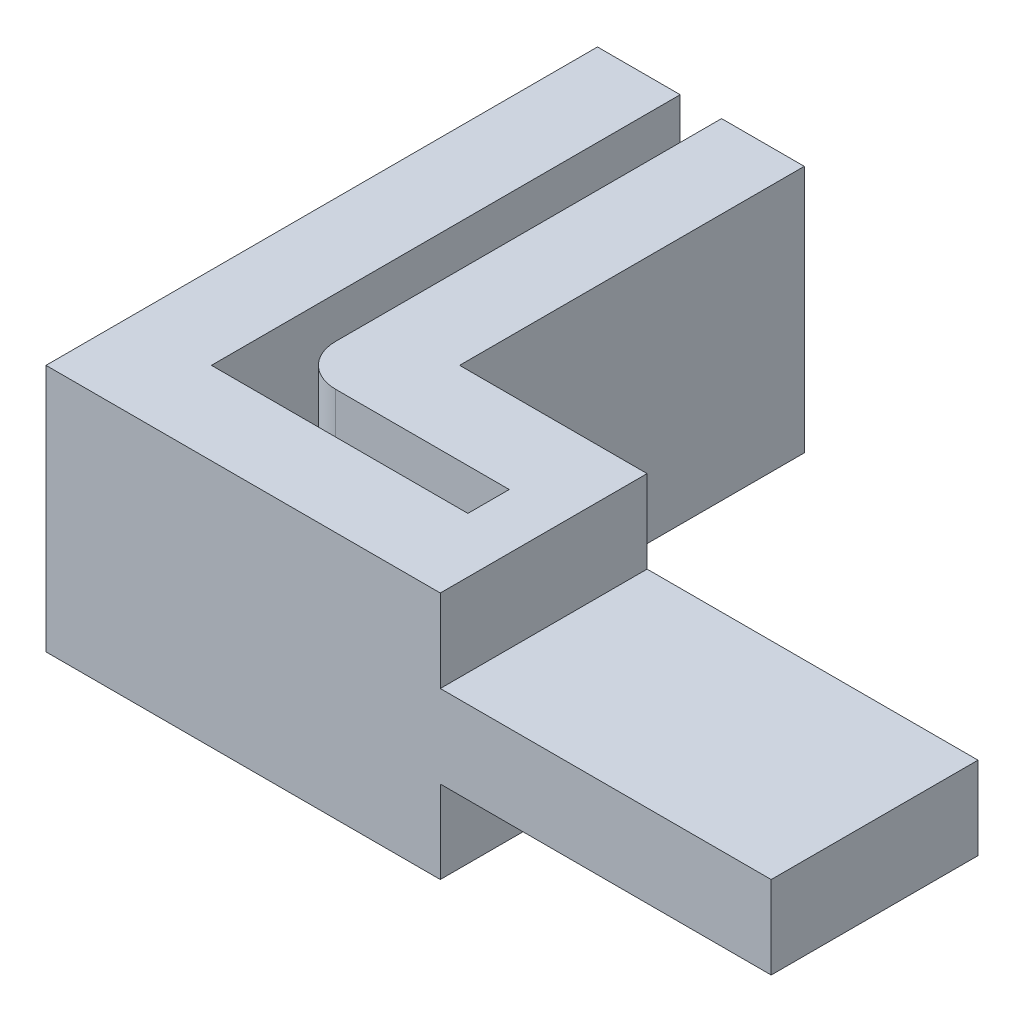
from build123d import *

# Parameters (mm, degrees)
SKETCH1_W           = 11.3
SKETCH1_H           = 3
SKETCH1_W_2         = 3
SKETCH1_H_2         = 12.5
BOSS_EXTRUDE1_DEPTH = 9
FILLET1_R           = 1.5
SKETCH2_W           = 7.5
SKETCH2_H           = 3
BOSS_EXTRUDE2_DEPTH = 12


with BuildPart() as part:
    # Sketch1 → Boss-Extrude1 (new body)
    with BuildSketch(Plane(origin=(0, 0, 0), x_dir=(1, 0, 0), z_dir=(0, 1, 0))):
        Polygon((-8.65, -1.5), (-5.65, -1.5), (-5.65, 1.5), (-5.65, 18.5), (-8.65, 18.5), align=None)
        Rectangle(SKETCH1_W, SKETCH1_H)
        Polygon((3.65, 1.5), (5.65, 1.5), (5.65, 6), (3.65, 6), (3.65, 3), align=None)
        Polygon((-4.15, 3), (3.65, 3), (3.65, 6), (-1.15, 6), (-4.15, 6), align=None)
        with Locations((-2.65, 12.25)):
            Rectangle(SKETCH1_W_2, SKETCH1_H_2)
    extrude(amount=BOSS_EXTRUDE1_DEPTH)

    # Fillet1
    fillet1_edges = [part.edges().sort_by_distance(p)[0] for p in [
        (-4.15, 4.5, -3),
    ]]
    fillet(fillet1_edges, radius=FILLET1_R)

    # Sketch2 → Boss-Extrude2 (add)
    with BuildSketch(Plane(origin=(5.65, 0, 0), x_dir=(0, 0, -1), z_dir=(1, 0, 0))):
        with Locations((2.25, 4.5)):
            Rectangle(SKETCH2_W, SKETCH2_H)
    extrude(amount=BOSS_EXTRUDE2_DEPTH)


solid = part.part
